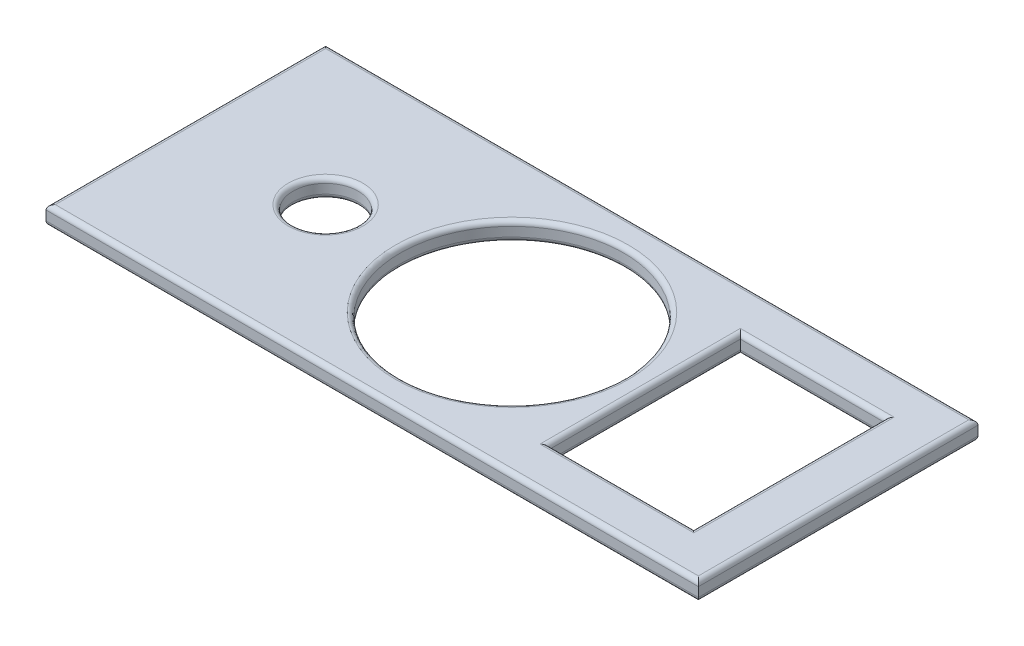
from build123d import *

# Parameters (mm, degrees)
SKETCH1_W           = 70
SKETCH1_H           = 30
SKETCH1_R           = 12
SKETCH1_R_2         = 3.5
SKETCH1_W_2         = 15.5
SKETCH1_H_2         = 20.5
BOSS_EXTRUDE1_DEPTH = 2
FILLET1_R           = 0.5


with BuildPart() as part:
    # Sketch1 → Boss-Extrude1 (new body)
    with BuildSketch(Plane(origin=(0, 0, 0), x_dir=(1, 0, 0), z_dir=(0, 1, 0))):
        Rectangle(SKETCH1_W, SKETCH1_H)
        with Locations(Location((0, 0, 0), (0, 0, 270))):
            Circle(SKETCH1_R, mode=Mode.SUBTRACT)
        with Locations(Location((-20, 0, 0), (0, 0, 270))):
            Circle(SKETCH1_R_2, mode=Mode.SUBTRACT)
        with Locations((22, 0)):
            Rectangle(SKETCH1_W_2, SKETCH1_H_2, mode=Mode.SUBTRACT)
    extrude(amount=BOSS_EXTRUDE1_DEPTH)

    # Fillet1
    fillet1_edges = [part.edges().sort_by_distance(p)[0] for p in [
        (0, 0, -12),
        (0, 2, -12),
        (35, 2, 0),
        (-20, 0, -3.5),
        (-20, 2, -3.5),
        (0, 2, -15),
        (14.25, 0, 0),
        (22, 0, 10.25),
        (29.75, 0, 0),
        (22, 0, -10.25),
        (14.25, 2, 0),
        (22, 2, 10.25),
        (29.75, 2, 0),
        (22, 2, -10.25),
        (-35, 2, 0),
        (0, 0, -15),
        (35, 0, 0),
        (0, 0, 15),
        (-35, 0, 0),
        (0, 2, 15),
    ]]
    fillet(fillet1_edges, radius=FILLET1_R)


solid = part.part
